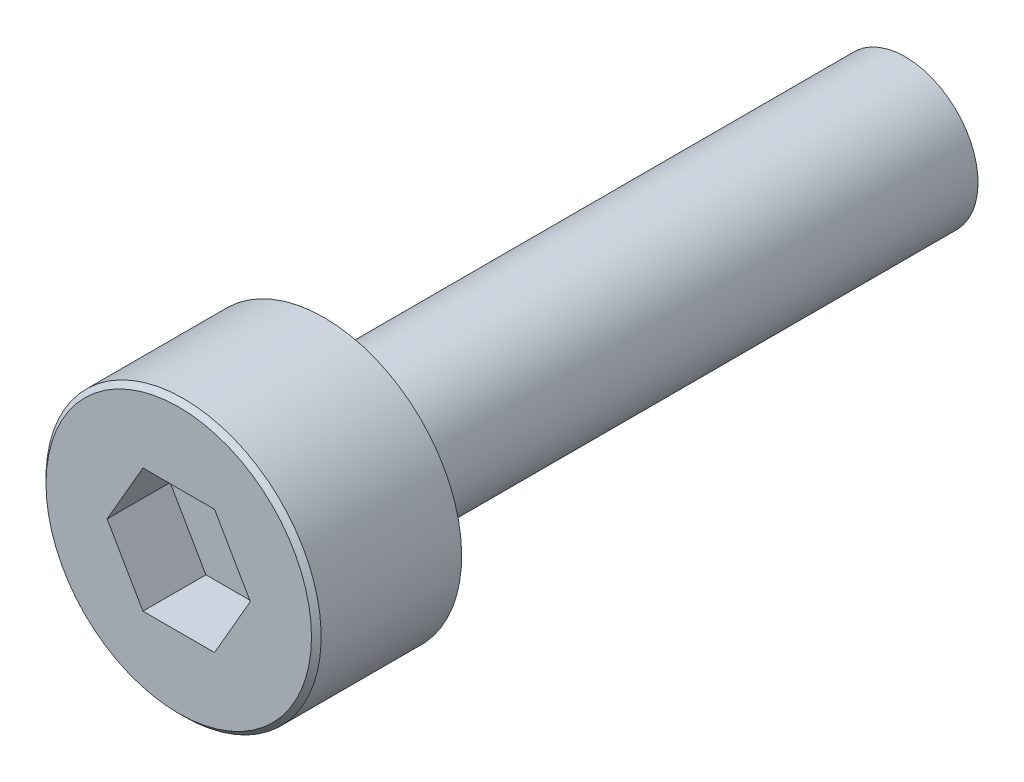
from build123d import *

# Parameters (mm, degrees)
CUT_EXTRUDE_1_DEPTH = 1.3
CHAMFER_620_SIZE    = 0.1


with BuildPart() as part:
    # 草图1 → 旋转1 (revolve)
    with BuildSketch(Plane(origin=(0, 0, 0), x_dir=(0, 0, -1), z_dir=(1, 0, 0))):
        Polygon((0, 0), (0, 2.84), (3, 2.84), (3, 1.5), (15, 1.5), (15, 0), align=None)
    revolve(axis=Axis((0, 0, -15), (0, 0, 1)))

    # 草图2 → 切除-拉伸1 (cut)
    with BuildSketch(Plane.XY):
        Polygon((0.739008345, 1.28), (-0.739008345, 1.28), (-1.478016689, 0), (-0.739008345, -1.28), (0.739008345, -1.28), (1.478016689, 0), align=None)
    extrude(amount=-CUT_EXTRUDE_1_DEPTH, mode=Mode.SUBTRACT)

    # Chamfer 620
    chamfer_620_edges = [part.edges().sort_by_distance(p)[0] for p in [
        (0, -2.84, 0),
    ]]
    chamfer(chamfer_620_edges, length=CHAMFER_620_SIZE)


solid = part.part
